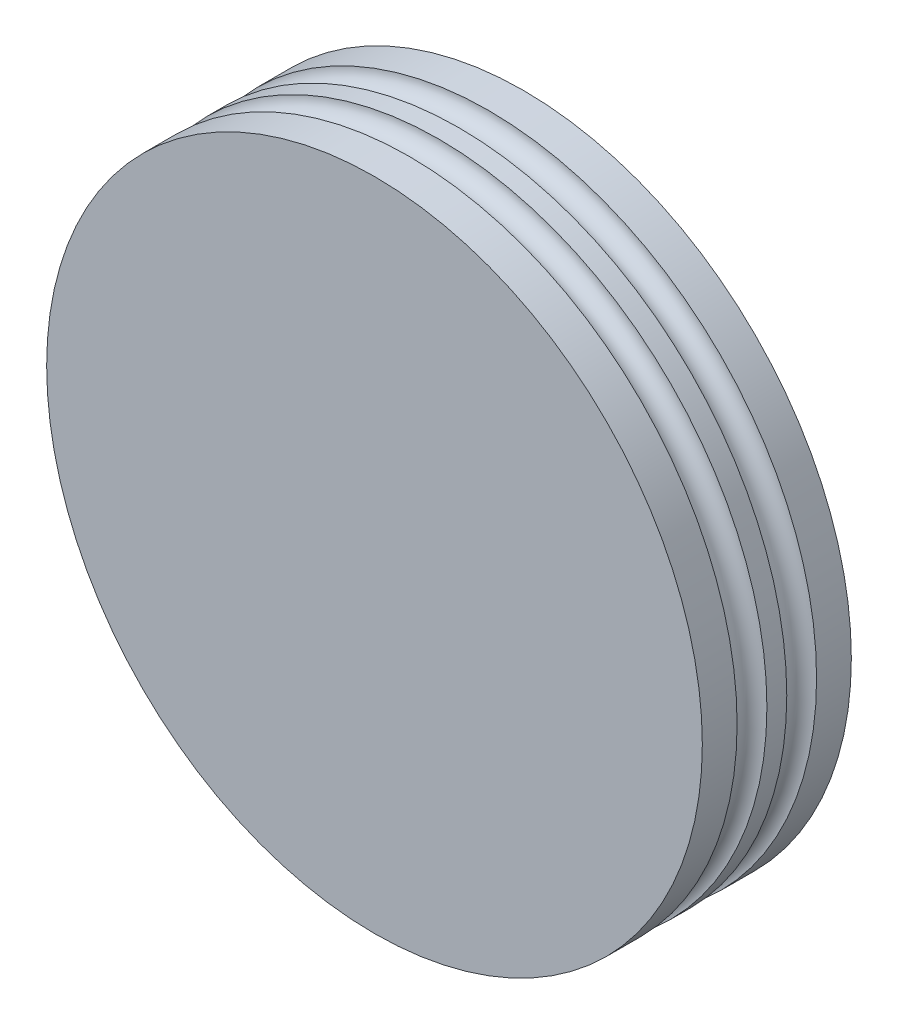
from build123d import *

# Parameters (mm, degrees)
CROQUIS1_R              = 5
SALIENTE_EXTRUIR1_DEPTH = 10
CROQUIS2_R              = 33
SALIENTE_EXTRUIR2_DEPTH = 15
CROQUIS3_R              = 1.5


with BuildPart() as part:
    # Croquis1 → Saliente-Extruir1 (new body)
    with BuildSketch(Plane.XY):
        Circle(CROQUIS1_R)
        with BuildLine():
            Line((-2.236067977, -2), (2.236067977, -2))
            ThreePointArc((2.236067977, -2), (3, 0), (2.236067977, 2))
            Line((2.236067977, 2), (-2.236067977, 2))
            ThreePointArc((-2.236067977, 2), (-3, 0), (-2.236067977, -2))
        make_face(mode=Mode.SUBTRACT)
    extrude(amount=SALIENTE_EXTRUIR1_DEPTH)

    # Croquis2 → Saliente-Extruir2 (add)
    with BuildSketch(Plane.XY.offset(10)):
        Circle(CROQUIS2_R)
    extrude(amount=SALIENTE_EXTRUIR2_DEPTH)

    # Croquis3 → Cortar-Revolución1 (revolve, cut)
    with BuildSketch(Plane(origin=(0, 0, 0), x_dir=(1, 0, 0), z_dir=(0, 1, 0))):
        with Locations((33, -15)):
            Circle(CROQUIS3_R)
        with Locations((33, -20)):
            Circle(CROQUIS3_R)
    revolve(axis=Axis((0, 0, 24.978866337), (0, 0, -1)), mode=Mode.SUBTRACT)


solid = part.part
